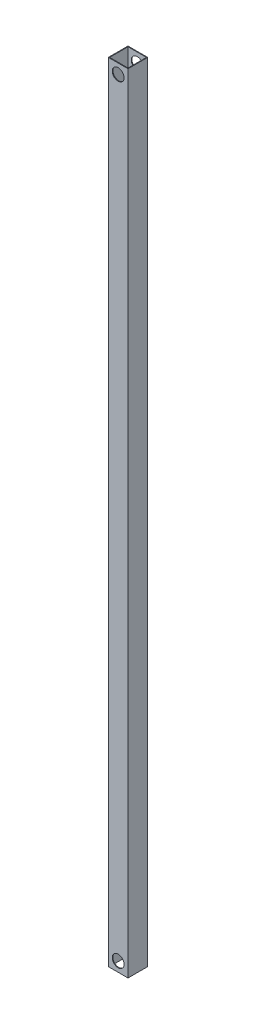
from build123d import *

# Parameters (mm, degrees)
CROQUIS1_W              = 10
CROQUIS1_H              = 10
SALIENTE_EXTRUIR1_DEPTH = 400
CROQUIS2_W              = 9.366
CROQUIS2_H              = 9.366
CORTAR_EXTRUIR1_DEPTH   = 500
CROQUIS3_R              = 3
CORTAR_EXTRUIR2_DEPTH   = 500
CROQUIS4_R              = 3
CORTAR_EXTRUIR3_DEPTH   = 500


with BuildPart() as part:
    # Croquis1 → Saliente-Extruir1 (new body)
    with BuildSketch(Plane(origin=(0, 0, 0), x_dir=(1, 0, 0), z_dir=(0, 1, 0))):
        Rectangle(CROQUIS1_W, CROQUIS1_H)
    extrude(amount=SALIENTE_EXTRUIR1_DEPTH)

    # Croquis2 → Cortar-Extruir1 (cut)
    with BuildSketch(Plane(origin=(0, 400, 0), x_dir=(1, 0, 0), z_dir=(0, 1, 0))):
        Rectangle(CROQUIS2_W, CROQUIS2_H)
    extrude(amount=-CORTAR_EXTRUIR1_DEPTH, mode=Mode.SUBTRACT)

    # Croquis3 → Cortar-Extruir2 (cut)
    with BuildSketch(Plane.XY.offset(5)):
        with Locations((0, 5)):
            Circle(CROQUIS3_R)
    extrude(amount=-CORTAR_EXTRUIR2_DEPTH, mode=Mode.SUBTRACT)

    # Croquis4 → Cortar-Extruir3 (cut)
    with BuildSketch(Plane.XY.offset(5)):
        with Locations((0, 395)):
            Circle(CROQUIS4_R)
    extrude(amount=-CORTAR_EXTRUIR3_DEPTH, mode=Mode.SUBTRACT)


solid = part.part
